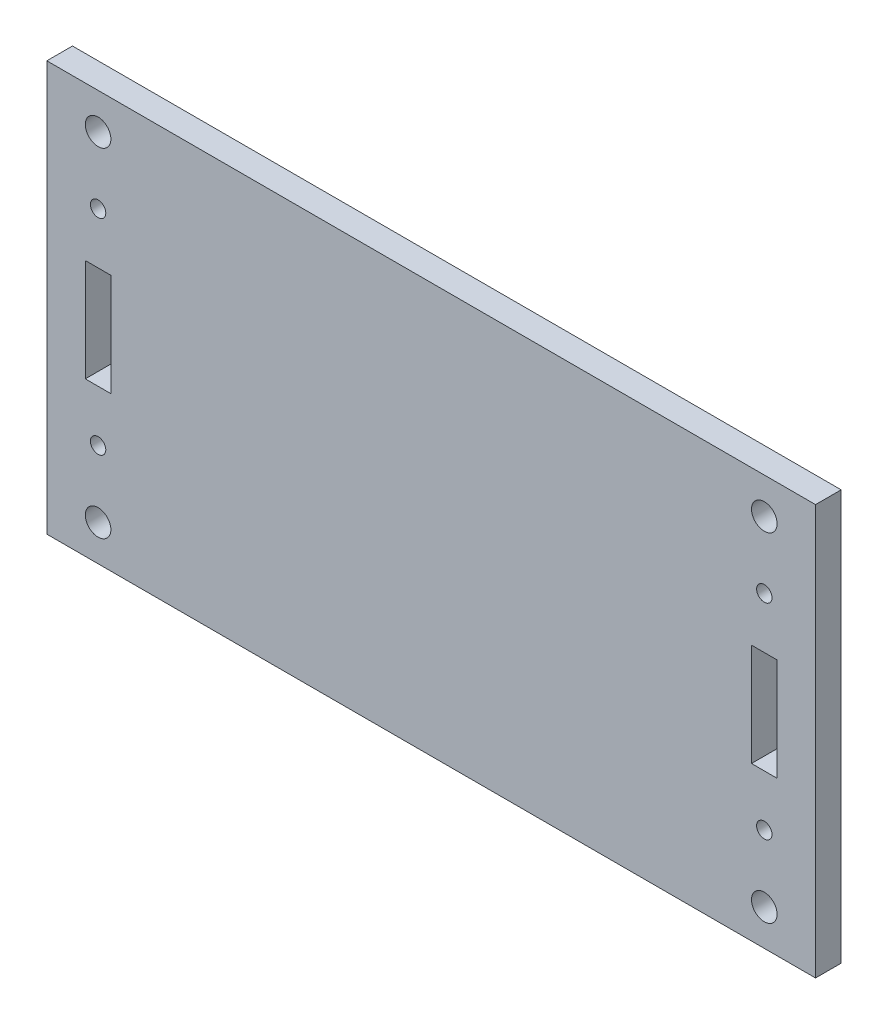
from build123d import *

# Parameters (mm, degrees)
SKETCH1_W           = 150
SKETCH1_H           = 80
SKETCH1_R           = 2.5
SKETCH1_R_2         = 1.5
SKETCH1_W_2         = 5
SKETCH1_H_2         = 20
BOSS_EXTRUDE1_DEPTH = 5


with BuildPart() as part:
    # Sketch1 → Boss-Extrude1 (new body)
    with BuildSketch(Plane.XY):
        with Locations((0, 10)):
            Rectangle(SKETCH1_W, SKETCH1_H)
        with Locations((-65, 43)):
            Circle(SKETCH1_R, mode=Mode.SUBTRACT)
        with Locations(Location((65, 43, 0), (0, 0, 180))):
            Circle(SKETCH1_R, mode=Mode.SUBTRACT)
        with Locations((65, -23)):
            Circle(SKETCH1_R, mode=Mode.SUBTRACT)
        with Locations(Location((-65, -23, 0), (0, 0, 180))):
            Circle(SKETCH1_R, mode=Mode.SUBTRACT)
        with Locations((-65, 30)):
            Circle(SKETCH1_R_2, mode=Mode.SUBTRACT)
        with Locations(Location((-65, -10, 0), (0, 0, 180))):
            Circle(SKETCH1_R_2, mode=Mode.SUBTRACT)
        with Locations((65, -10)):
            Circle(SKETCH1_R_2, mode=Mode.SUBTRACT)
        with Locations(Location((65, 30, 0), (0, 0, 180))):
            Circle(SKETCH1_R_2, mode=Mode.SUBTRACT)
        with Locations((-65, 10)):
            Rectangle(SKETCH1_W_2, SKETCH1_H_2, mode=Mode.SUBTRACT)
        with Locations((65, 10)):
            Rectangle(SKETCH1_W_2, SKETCH1_H_2, mode=Mode.SUBTRACT)
    extrude(amount=BOSS_EXTRUDE1_DEPTH)


solid = part.part
